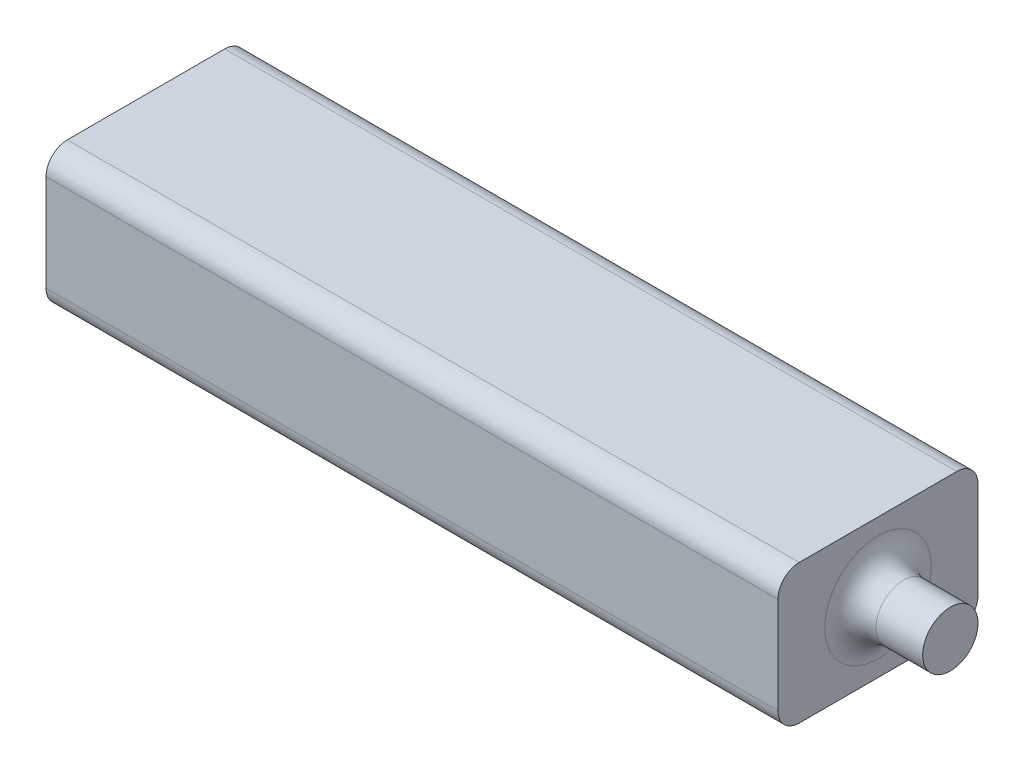
from build123d import *

# Parameters (mm, degrees)
BOSS_EXTRUDE1_DEPTH = 43
SKETCH2_R           = 3.25
BOSS_EXTRUDE2_DEPTH = 8.5
FILLET1_R           = 3
SKETCH3_W           = 12
SKETCH3_H           = 4.6
CUT_EXTRUDE1_DEPTH  = 5


with BuildPart() as part:
    # Sketch1 → Boss-Extrude1 (new, symmetric)
    with BuildSketch(Plane(origin=(0, 0, 0), x_dir=(0, 0, -1), z_dir=(1, 0, 0))):
        with BuildLine():
            Line((-9.25, -8.175), (9.25, -8.175))
            ThreePointArc((9.25, -8.175), (11.017766953, -7.442766953), (11.75, -5.675))
            Line((11.75, -5.675), (11.75, 5.675))
            ThreePointArc((11.75, 5.675), (11.017766953, 7.442766953), (9.25, 8.175))
            Line((9.25, 8.175), (-9.25, 8.175))
            ThreePointArc((-9.25, 8.175), (-11.017766953, 7.442766953), (-11.75, 5.675))
            Line((-11.75, 5.675), (-11.75, -5.675))
            ThreePointArc((-11.75, -5.675), (-11.017766953, -7.442766953), (-9.25, -8.175))
        make_face()
    extrude(amount=BOSS_EXTRUDE1_DEPTH, both=True)

    # Sketch2 → Boss-Extrude2 (add)
    with BuildSketch(Plane(origin=(43, 0, 0), x_dir=(0, 0, -1), z_dir=(1, 0, 0))):
        with Locations(Location((0, 0, 0), (0, 0, 180))):
            Circle(SKETCH2_R)
    extrude(amount=BOSS_EXTRUDE2_DEPTH)

    # Fillet1
    fillet1_edges = [part.edges().sort_by_distance(p)[0] for p in [
        (43, 0, -3.25),
    ]]
    fillet(fillet1_edges, radius=FILLET1_R)

    # Sketch3 → Cut-Extrude1 (cut)
    with BuildSketch(Plane(origin=(0, 0, -11.75), x_dir=(-1, 0, 0), z_dir=(0, 0, -1))):
        with Locations((5.5, -1.625)):
            Rectangle(SKETCH3_W, SKETCH3_H)
        with Locations((-12, -1.625)):
            Rectangle(SKETCH3_W, SKETCH3_H)
        with Locations((-29.5, -1.625)):
            Rectangle(SKETCH3_W, SKETCH3_H)
    extrude(amount=-CUT_EXTRUDE1_DEPTH, mode=Mode.SUBTRACT)


solid = part.part
